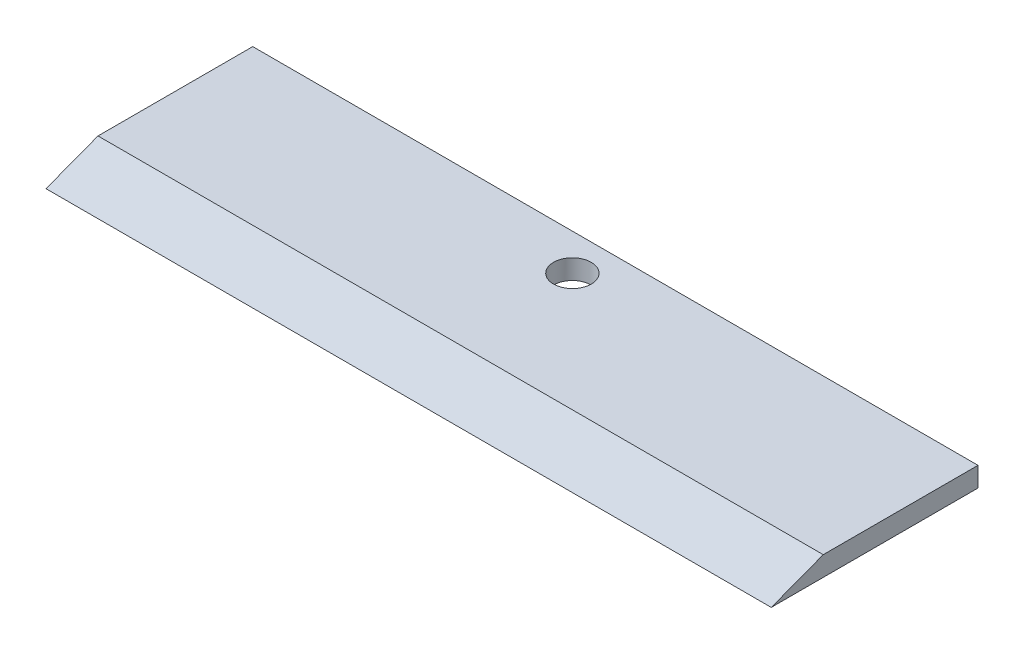
from build123d import *

# Parameters (mm, degrees)
SKETCH1_W           = 22.1
SKETCH1_H           = 6.3
BOSS_EXTRUDE1_DEPTH = 0.6
CUT_EXTRUDE1_DEPTH  = 24.73
SKETCH4_R           = 0.575
CUT_EXTRUDE2_DEPTH  = 2.54


with BuildPart() as part:
    # Sketch1 → Boss-Extrude1 (new body)
    with BuildSketch(Plane(origin=(0, 0, 0), x_dir=(1, 0, 0), z_dir=(0, 1, 0))):
        with Locations((11.05, 3.15)):
            Rectangle(SKETCH1_W, SKETCH1_H)
    extrude(amount=BOSS_EXTRUDE1_DEPTH)

    # Sketch3 → Cut-Extrude1 (cut)
    with BuildSketch(Plane(origin=(22.1, 0, 0), x_dir=(0, 0, -1), z_dir=(1, 0, 0))):
        Polygon((0, 0.6), (0, 0), (1.584478717, 0.6), align=None)
    extrude(amount=-CUT_EXTRUDE1_DEPTH, mode=Mode.SUBTRACT)

    # Sketch4 → Cut-Extrude2 (cut)
    with BuildSketch(Plane(origin=(0, 0.6, 0), x_dir=(1, 0, 0), z_dir=(0, 1, 0))):
        with Locations(Location((10.85, 5.189909292, 0), (0, 0, 270))):
            Circle(SKETCH4_R)
    extrude(amount=-CUT_EXTRUDE2_DEPTH, mode=Mode.SUBTRACT)


solid = part.part
